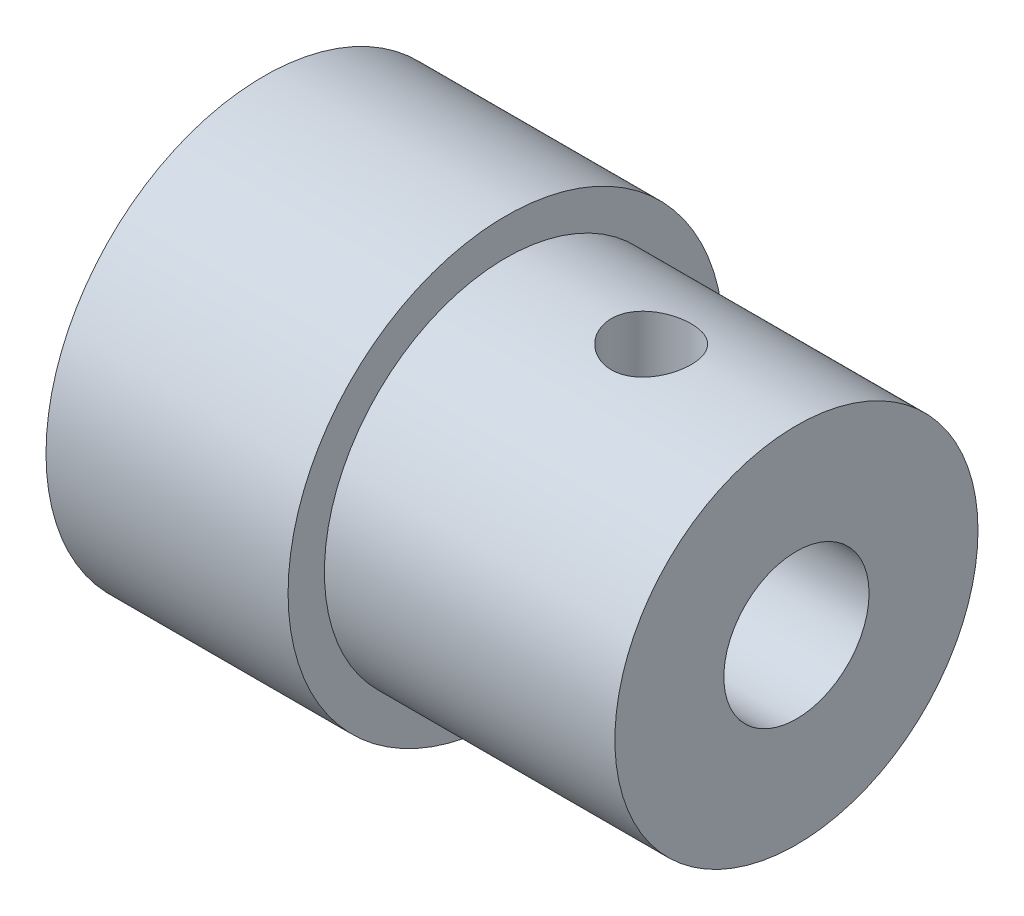
from build123d import *

# Parameters (mm, degrees)
ESBO_O1_R                = 9
RESSALTO_EXTRUS_O1_DEPTH = 11
ESBO_O2_R                = 9
ESBO_O2_R_2              = 7.5
CORTE_EXTRUS_O1_DEPTH    = 12
ESBO_O3_R                = 3
CORTE_EXTRUS_O2_DEPTH    = 16
CORTE_EXTRUS_O3_REACH    = 27.417
ESBO_O4_R                = 2.1
ESBO_O8_R                = 1.65
CORTE_EXTRUS_O4_DEPTH    = 17.822603841


with BuildPart() as part:
    # Esboço1 → Ressalto-extrusão1 (new, symmetric)
    with BuildSketch(Plane(origin=(0, 0, 0), x_dir=(0, 0, -1), z_dir=(1, 0, 0))):
        Circle(ESBO_O1_R)
    extrude(amount=RESSALTO_EXTRUS_O1_DEPTH, both=True)

    # Esboço2 → Corte-extrusão1 (cut)
    with BuildSketch(Plane(origin=(11, 0, 0), x_dir=(0, 0, -1), z_dir=(1, 0, 0))):
        Circle(ESBO_O2_R)
        Circle(ESBO_O2_R_2, mode=Mode.SUBTRACT)
    extrude(amount=-CORTE_EXTRUS_O1_DEPTH, mode=Mode.SUBTRACT)

    # Esboço3 → Corte-extrusão2 (cut)
    with BuildSketch(Plane(origin=(11, 0, 0), x_dir=(0, 0, -1), z_dir=(1, 0, 0))):
        Circle(ESBO_O3_R)
    extrude(amount=-CORTE_EXTRUS_O2_DEPTH, mode=Mode.SUBTRACT)

    # Esboço4 → Corte-extrusão3 (cut, up to next)
    with BuildSketch(Plane.ZY.offset(11), mode=Mode.PRIVATE) as corte_extrus_o3_sk1:
        Circle(ESBO_O4_R)
    corte_extrus_o3_tool1 = extrude(corte_extrus_o3_sk1.sketch, amount=-CORTE_EXTRUS_O3_REACH, mode=Mode.PRIVATE) & part.part
    add(corte_extrus_o3_tool1.solids().sort_by_distance((-11, 0, 0))[0], mode=Mode.SUBTRACT)

    # Esboço8 → Corte-extrusão4 (cut, through all)
    with BuildSketch(Plane(origin=(0, 0, 0), x_dir=(1, 0, 0), z_dir=(0, 1, 0))):
        with Locations(Location((5, 0, 0), (0, 0, 90))):
            Circle(ESBO_O8_R)
    extrude(amount=CORTE_EXTRUS_O4_DEPTH, mode=Mode.SUBTRACT)


solid = part.part
